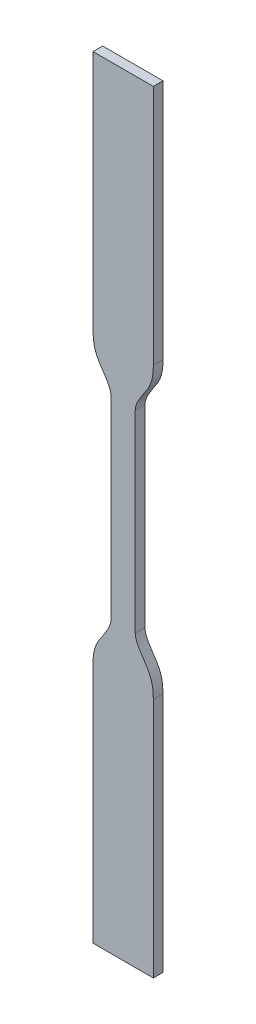
from build123d import *

# Parameters (mm, degrees)
BOSS_EXTRUDE1_DEPTH = 2.54


with BuildPart() as part:
    # Sketch1 → Boss-Extrude1 (new body)
    with BuildSketch(Plane.XY):
        with BuildLine():
            Line((-7.9375, -101.6), (7.9375, -101.6))
            Line((7.9375, -101.6), (7.9375, -38.1))
            add(Edge.make_bspline(
                [(7.9375, -38.1), (7.9375, -35.419414326), (7.08508997, -31.89666435), (3.252877068, -27.63987608), (3.175, -25.4)],
                knots=[0, 0, 0, 0, 0.475835687, 1, 1, 1, 1], degree=3))
            Line((3.175, -25.4), (3.175, 25.4))
            add(Edge.make_bspline(
                [(7.9375, 38.1), (7.9375, 35.419414326), (7.08508997, 31.89666435), (3.252877068, 27.63987608), (3.175, 25.4)],
                knots=[0, 0, 0, 0, 0.475835687, 1, 1, 1, 1], degree=3))
            Line((7.9375, 38.1), (7.9375, 101.6))
            Line((7.9375, 101.6), (-7.9375, 101.6))
            Line((-7.9375, 101.6), (-7.9375, 38.1))
            add(Edge.make_bspline(
                [(-7.9375, 38.1), (-7.9375, 35.419414326), (-7.08508997, 31.89666435), (-3.252877068, 27.63987608), (-3.175, 25.4)],
                knots=[0, 0, 0, 0, 0.475835687, 1, 1, 1, 1], degree=3))
            Line((-3.175, 25.4), (-3.175, -25.4))
            add(Edge.make_bspline(
                [(-7.9375, -38.1), (-7.9375, -35.419414326), (-7.08508997, -31.89666435), (-3.252877068, -27.63987608), (-3.175, -25.4)],
                knots=[0, 0, 0, 0, 0.475835687, 1, 1, 1, 1], degree=3))
            Line((-7.9375, -38.1), (-7.9375, -101.6))
        make_face()
    extrude(amount=BOSS_EXTRUDE1_DEPTH)


solid = part.part
